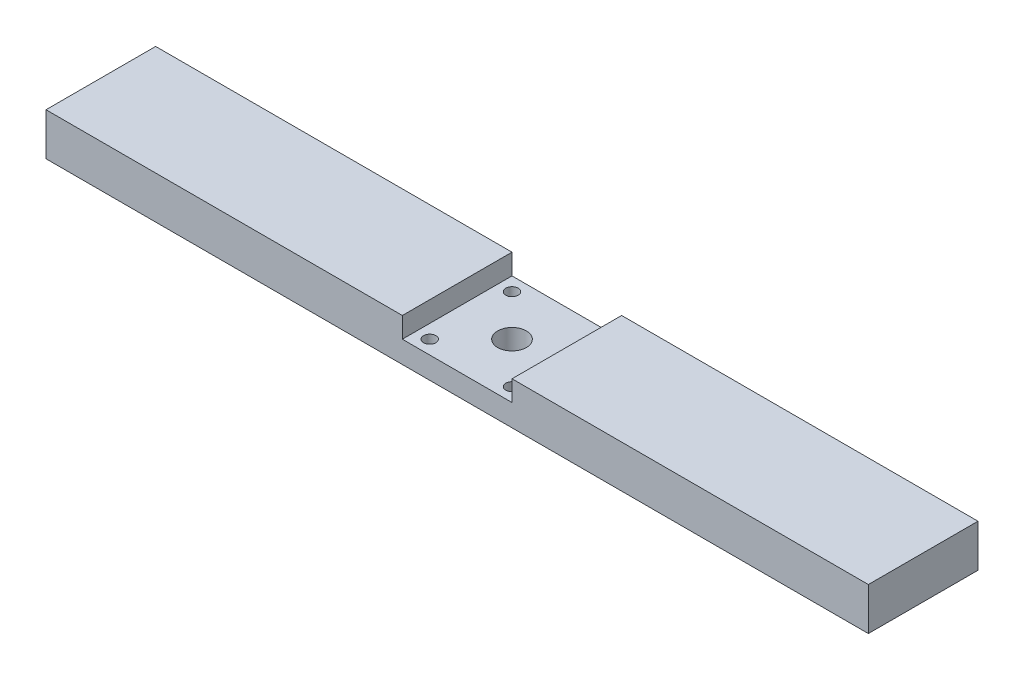
from build123d import *

# Parameters (mm, degrees)
BOSS_EXTRUDE1_DEPTH = 20
SKETCH2_R           = 2.25
SKETCH2_R_2         = 5.25
CUT_EXTRUDE1_DEPTH  = 40


with BuildPart() as part:
    # Sketch1 → Boss-Extrude1 (new, symmetric)
    with BuildSketch(Plane.XY):
        Polygon((-150, 7.75), (-150, -7.75), (150, -7.75), (150, 7.75), (20, 7.75), (20, 0.25), (-20, 0.25), (-20, 7.75), align=None)
    extrude(amount=BOSS_EXTRUDE1_DEPTH, both=True)

    # Sketch2 → Cut-Extrude1 (cut)
    with BuildSketch(Plane(origin=(0, 0.25, 0), x_dir=(1, 0, 0), z_dir=(0, 1, 0))):
        with Locations(Location((15.015, 15, 0), (0, 0, 270))):
            Circle(SKETCH2_R)
        with Locations(Location((-15.015, 15, 0), (0, 0, 180))):
            Circle(SKETCH2_R)
        with Locations(Location((15.015, -15, 0), (0, 0, 180))):
            Circle(SKETCH2_R)
        with Locations(Location((-15.015, -15, 0), (0, 0, 270))):
            Circle(SKETCH2_R)
        with Locations(Location((0, 0, 0), (0, 0, 270))):
            Circle(SKETCH2_R_2)
    extrude(amount=-CUT_EXTRUDE1_DEPTH, mode=Mode.SUBTRACT)


solid = part.part
